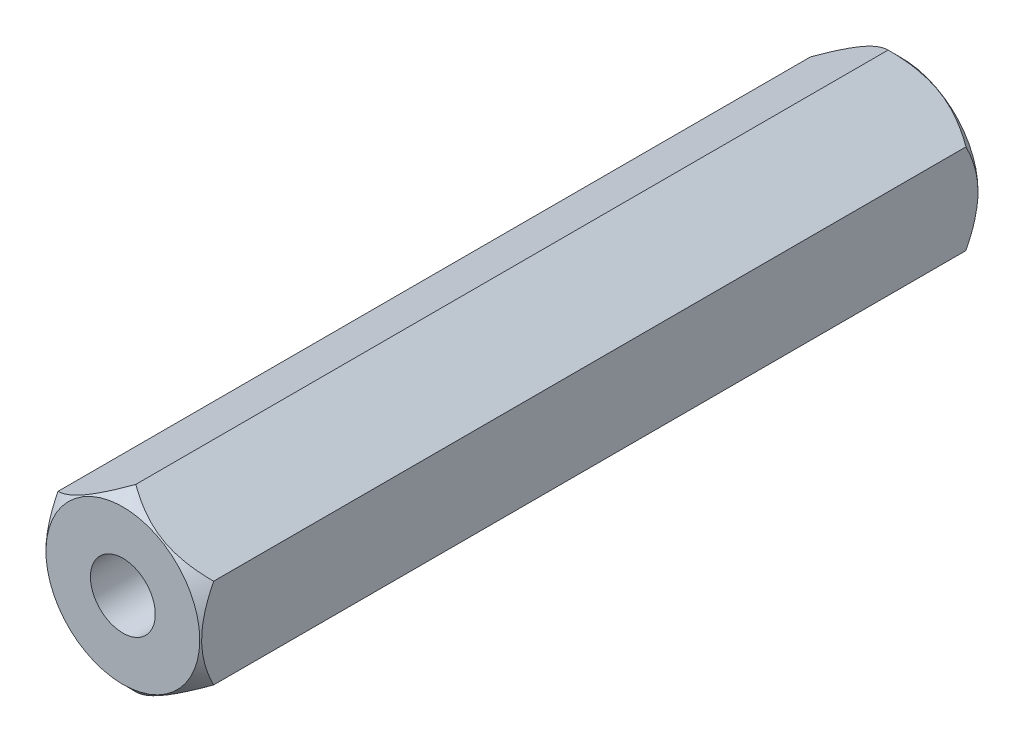
from build123d import *

# Parameters (mm, degrees)
BOSS_EXTRU_1_DEPTH                        = 30
TROU_POUR_TARAUDAGE_POUR_TROU_TARAUD_M3_D = 2.5


with BuildPart() as part:
    # Esquisse1 → Boss.-Extru.1 (new body)
    with BuildSketch(Plane.XY):
        Polygon((0, 3.464101615), (-3, 1.732050808), (-3, -1.732050808), (0, -3.464101615), (3, -1.732050808), (3, 1.732050808), align=None)
    extrude(amount=BOSS_EXTRU_1_DEPTH)

    # Esquisse2 → Enlèvement de matière-Révolution1 (revolve, cut)
    with BuildSketch(Plane(origin=(0, 0, 0), x_dir=(0, 0, -1), z_dir=(1, 0, 0)), mode=Mode.PRIVATE) as enl_vement_de_mati_re_r_volution1_sk:
        Polygon((-30, 2.964101615), (-29.5, 3.464101615), (-29.5, 7.964101615), (-34.5, 7.964101615), (-34.5, 2.964101615), align=None)
        Polygon((0, 2.964101615), (4.5, 2.964101615), (4.5, 7.964101615), (-0.5, 7.964101615), (-0.5, 3.464101615), align=None)
    revolve(enl_vement_de_mati_re_r_volution1_sk.sketch.rotate(Axis((0, 0, 1000), (0, 0, -1)), 300.000000159), axis=Axis((0, 0, 1000), (0, 0, -1)), mode=Mode.SUBTRACT)

    # Trou pour taraudage pour trou taraudé M31 (through all)
    with Locations(Plane(origin=(0, 0, 0), x_dir=(-1, 0, 0), z_dir=(0, 0, -1))):
        with Locations((0, 0)):
            Hole(TROU_POUR_TARAUDAGE_POUR_TROU_TARAUD_M3_D / 2)


solid = part.part
